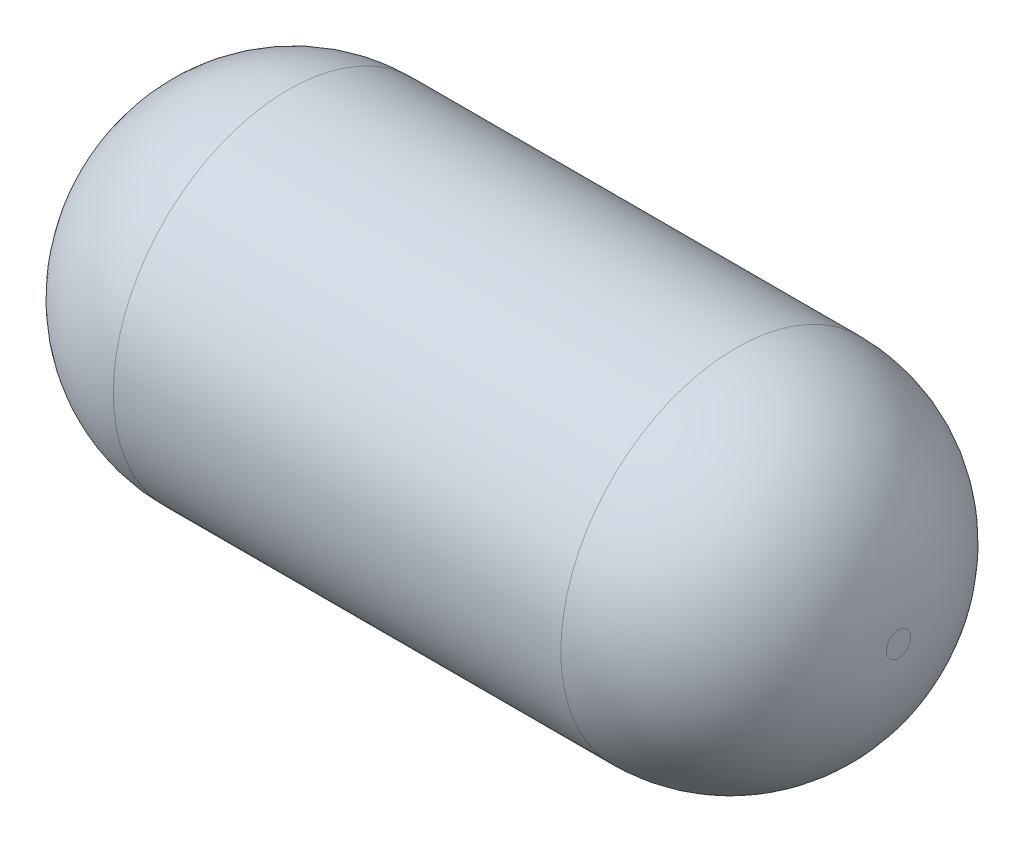
from build123d import *


with BuildPart() as part:
    # Sketch1 → Revolve1 (revolve)
    with BuildSketch(Plane(origin=(0, 0, 0), x_dir=(1, 0, 0), z_dir=(0, 1, 0)), mode=Mode.PRIVATE) as revolve1_sk:
        with BuildLine():
            Line((-75.614381494, 0), (165.685618506, 0))
            Line((165.685618506, 0), (165.685618506, 3.81))
            ThreePointArc((165.685618506, 3.81), (150.80664299, 39.731024484), (114.885618506, 54.61))
            Line((114.885618506, 54.61), (-24.814381494, 54.61))
            ThreePointArc((-24.814381494, 54.61), (-60.735405978, 39.731024484), (-75.614381494, 3.81))
            Line((-75.614381494, 3.81), (-75.614381494, 0))
        make_face()
    revolve(revolve1_sk.sketch.rotate(Axis((-75.614381494, 0, 0), (1, 0, 0)), 180), axis=Axis((-75.614381494, 0, 0), (1, 0, 0)))


solid = part.part
